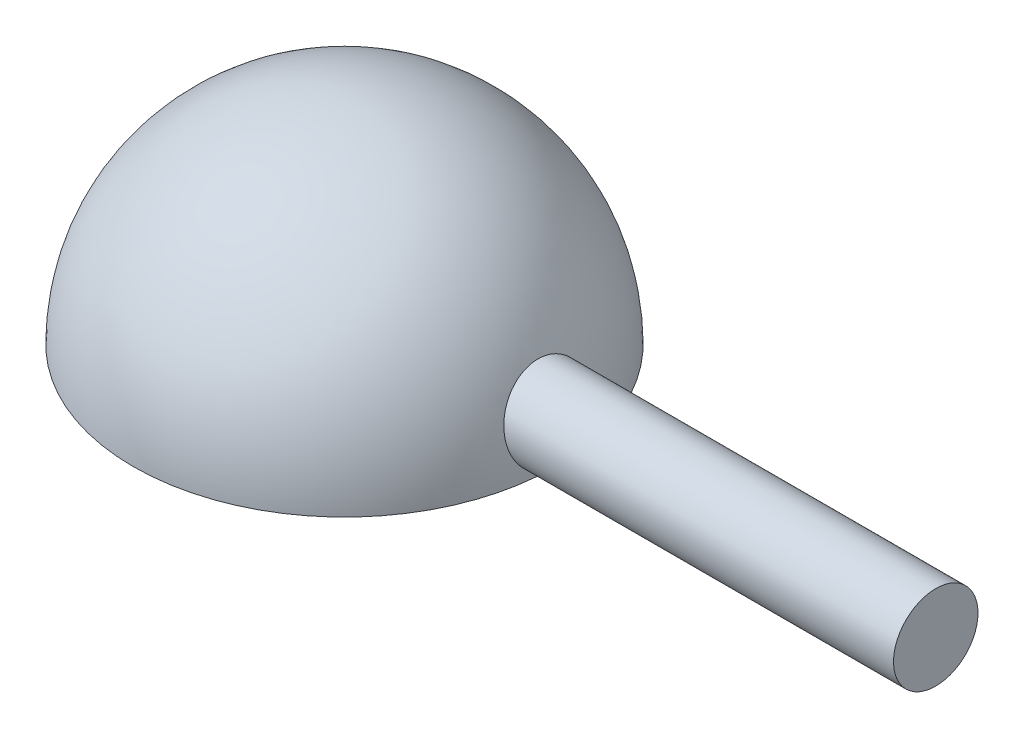
from build123d import *

# Parameters (mm, degrees)
CIRKEL_R                   = 5
ARM_DEPTH                  = 45
ARM_DIRECTION_2_REACH      = 63.237
ARM_DIRECTION_2_END_RADIUS = 25


with BuildPart() as part:
    # boog → bol_half (revolve)
    with BuildSketch(Plane.XY):
        with BuildLine():
            Line((-25, 0), (-22, 0))
            ThreePointArc((-22, 0), (-15.556349186, 15.556349186), (0, 22))
            Line((0, 22), (0, 25))
            ThreePointArc((0, 25), (-17.67766953, 17.67766953), (-25, 0))
        make_face()
    revolve(axis=Axis((0, 0, 0), (0, 1, 0)))

    # cirkel → arm (add)
    with BuildSketch(Plane(origin=(25, 0, 0), x_dir=(0, 0, -1), z_dir=(1, 0, 0))):
        with Locations((0, 5)):
            Circle(CIRKEL_R)
    extrude(amount=ARM_DEPTH)

    # arm direction 2: up to this sphere (the profile starts outside it)
    arm_direction_2_end = Location((0, 0, 0)) * Sphere(ARM_DIRECTION_2_END_RADIUS, mode=Mode.PRIVATE)
    # cirkel → arm direction 2 (add, up to the surface)
    with BuildSketch(Plane(origin=(25, 0, 0), x_dir=(0, 0, -1), z_dir=(1, 0, 0)), mode=Mode.PRIVATE) as arm_direction_2_sk1:
        with Locations((0, 5)):
            Circle(CIRKEL_R)
    arm_direction_2_tool1 = extrude(arm_direction_2_sk1.sketch, amount=-ARM_DIRECTION_2_REACH, mode=Mode.PRIVATE) - arm_direction_2_end
    add(arm_direction_2_tool1.solids().sort_by_distance((25, 5, 0))[0])


solid = part.part
